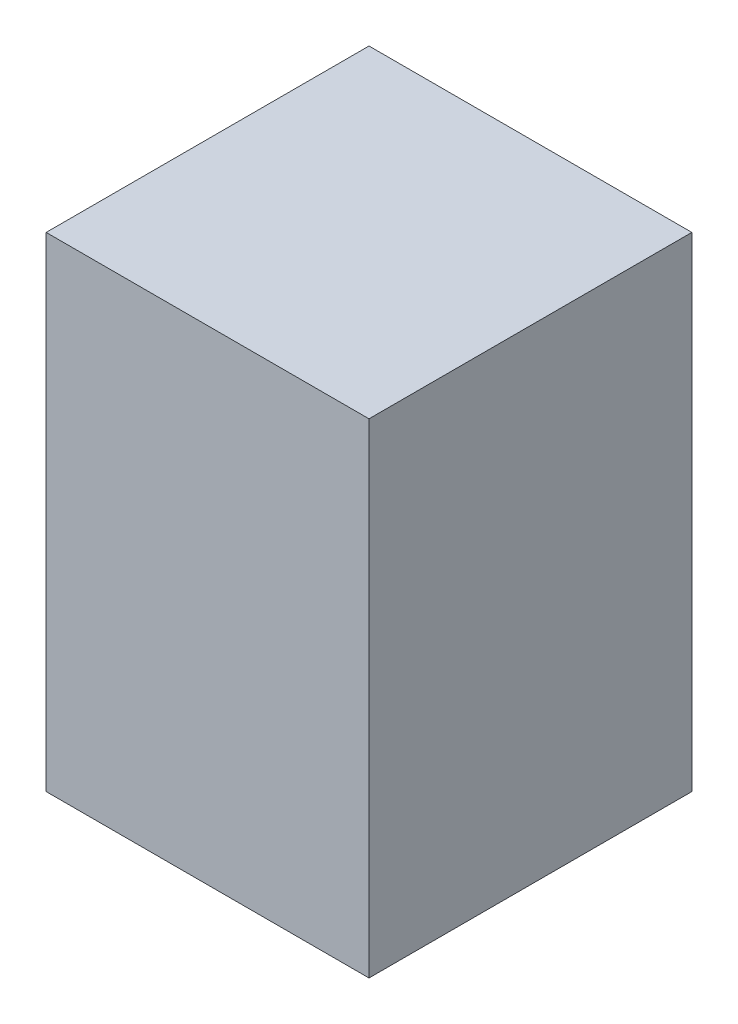
from build123d import *

# Parameters (mm, degrees)
PRESS_AYAK_4_1_START = -680
SKETCH1_W            = 80
SKETCH1_H            = 120
PRESS_AYAK_4_1_DEPTH = 80


with BuildPart() as part:
    # Sketch1 → PRESS_ayak_4_1 (new body)
    with BuildSketch(Plane.XY.offset(PRESS_AYAK_4_1_START)):
        with Locations((600, 60)):
            Rectangle(SKETCH1_W, SKETCH1_H)
    extrude(amount=-PRESS_AYAK_4_1_DEPTH)


solid = part.part
